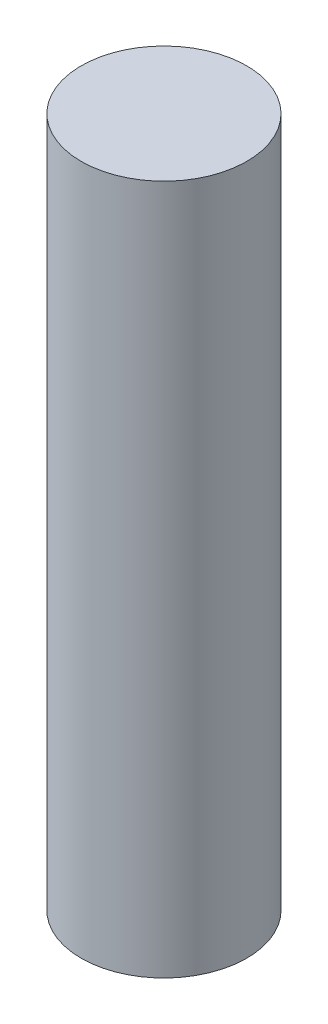
from build123d import *

# Parameters (mm, degrees)
SKETCH1_R           = 12
BOSS_EXTRUDE1_DEPTH = 100


with BuildPart() as part:
    # Sketch1 → Boss-Extrude1 (new body)
    with BuildSketch(Plane(origin=(0, 0, 0), x_dir=(1, 0, 0), z_dir=(0, 1, 0))):
        with Locations(Location((0, 0, 0), (0, 0, 270))):
            Circle(SKETCH1_R)
    extrude(amount=BOSS_EXTRUDE1_DEPTH)


solid = part.part
